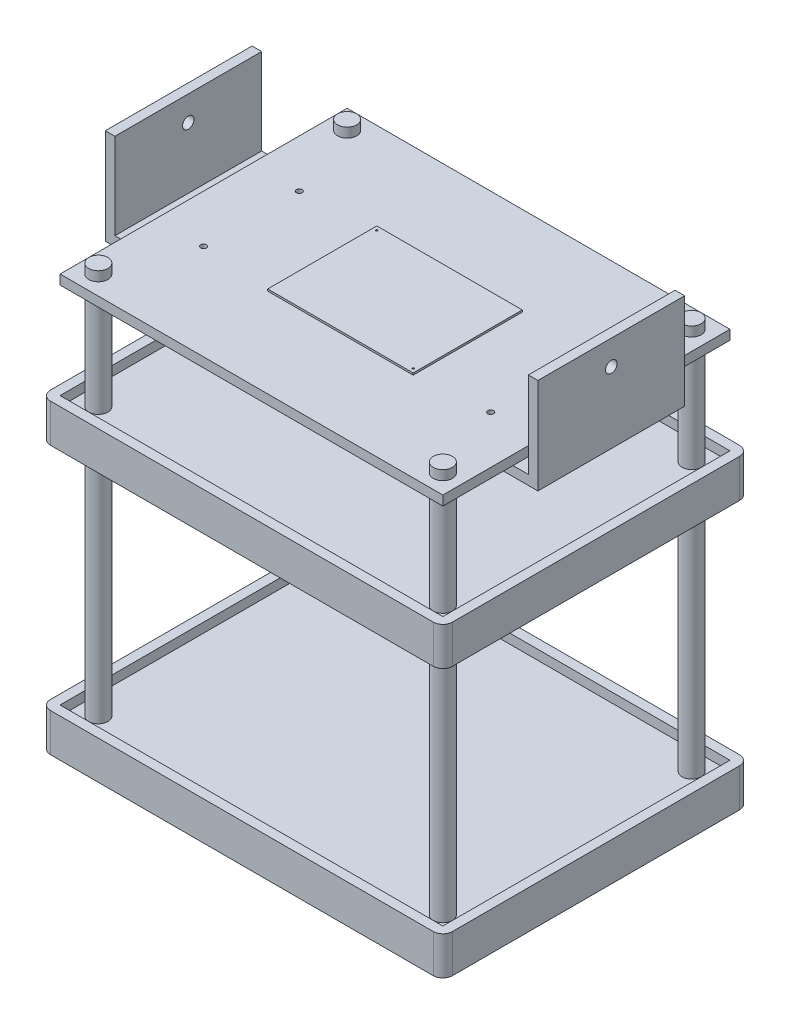
from build123d import *

# Parameters (mm, degrees)
SKETCH1_W            = 200
SKETCH1_H            = 150
BOSS_EXTRUDE1_DEPTH  = 5
SKETCH2_R            = 5
CUT_EXTRUDE1_DEPTH   = 10
SKETCH3_W            = 200
SKETCH3_H            = 150
SKETCH3_R            = 5
BOSS_EXTRUDE2_DEPTH  = 5
SKETCH4_W            = 200
SKETCH4_H            = 150
SKETCH4_R            = 5
BOSS_EXTRUDE3_DEPTH  = 5
BOSS_EXTRUDE13_START = 205
SKETCH21_R           = 5
BOSS_EXTRUDE13_DEPTH = 205
SKETCH22_R           = 5
BOSS_EXTRUDE14_DEPTH = 15
SKETCH23_R           = 1.5
CUT_EXTRUDE2_DEPTH   = 10
SKETCH27_W           = 76
SKETCH27_H           = 57
BOSS_EXTRUDE16_DEPTH = 1
SKETCH30_R           = 0.5
CUT_EXTRUDE3_DEPTH   = 30
SKETCH35_W           = 210
SKETCH35_H           = 160
SKETCH35_W_2         = 200
SKETCH35_H_2         = 150
BOSS_EXTRUDE19_DEPTH = 10
FILLET4_R            = 5
SKETCH39_W           = 210
SKETCH39_H           = 160
SKETCH39_W_2         = 200
SKETCH39_H_2         = 150
BOSS_EXTRUDE20_DEPTH = 10
FILLET5_R            = 5
SKETCH42_W           = 15
SKETCH42_H           = 20
SKETCH42_W_2         = 25
SKETCH42_H_2         = 50
SKETCH42_W_3         = 43.3
SKETCH42_H_3         = 43.3
BOSS_EXTRUDE23_DEPTH = 1
SKETCH46_W           = 30
SKETCH46_H           = 76.670556204
BOSS_EXTRUDE24_DEPTH = 5
SKETCH48_W           = 76.670556204
SKETCH48_H           = 50
BOSS_EXTRUDE25_DEPTH = 5
SKETCH49_R           = 3
CUT_EXTRUDE4_DEPTH   = 5
SKETCH54_W           = 76.670556204
SKETCH54_H           = 50
BOSS_EXTRUDE26_DEPTH = 5
CUT_EXTRUDE5_START   = -5
SKETCH55_R           = 3
CUT_EXTRUDE5_DEPTH   = 5


with BuildPart() as part:
    # Sketch1 → Boss-Extrude1 (new body)
    with BuildSketch(Plane(origin=(0, 0, 0), x_dir=(1, 0, 0), z_dir=(0, 1, 0))):
        Rectangle(SKETCH1_W, SKETCH1_H)
    extrude(amount=BOSS_EXTRUDE1_DEPTH)

    # Sketch2 → Cut-Extrude1 (cut)
    with BuildSketch(Plane(origin=(0, 5, 0), x_dir=(1, 0, 0), z_dir=(0, 1, 0))):
        with Locations(Location((-90, 65, 0), (0, 0, 270))):
            Circle(SKETCH2_R)
        with Locations(Location((90, 65, 0), (0, 0, 270))):
            Circle(SKETCH2_R)
        with Locations(Location((90, -65, 0), (0, 0, 270))):
            Circle(SKETCH2_R)
        with Locations(Location((-90, -65, 0), (0, 0, 270))):
            Circle(SKETCH2_R)
    extrude(amount=-CUT_EXTRUDE1_DEPTH, mode=Mode.SUBTRACT)



with BuildPart() as body_2:
    # Sketch3 → Boss-Extrude2 (new body)
    with BuildSketch(Plane(origin=(0, 140, 0), x_dir=(1, 0, 0), z_dir=(0, 1, 0))):
        Rectangle(SKETCH3_W, SKETCH3_H)
        with Locations(Location((-90, 65, 0), (0, 0, 270))):
            Circle(SKETCH3_R, mode=Mode.SUBTRACT)
        with Locations(Location((90, 65, 0), (0, 0, 270))):
            Circle(SKETCH3_R, mode=Mode.SUBTRACT)
        with Locations(Location((-90, -65, 0), (0, 0, 270))):
            Circle(SKETCH3_R, mode=Mode.SUBTRACT)
        with Locations(Location((90, -65, 0), (0, 0, 270))):
            Circle(SKETCH3_R, mode=Mode.SUBTRACT)
    extrude(amount=BOSS_EXTRUDE2_DEPTH)



with BuildPart() as body_3:
    # Sketch4 → Boss-Extrude3 (new body)
    with BuildSketch(Plane(origin=(0, 200, 0), x_dir=(1, 0, 0), z_dir=(0, 1, 0))):
        Rectangle(SKETCH4_W, SKETCH4_H)
        with Locations(Location((-90, 65, 0), (0, 0, 270))):
            Circle(SKETCH4_R, mode=Mode.SUBTRACT)
        with Locations(Location((90, 65, 0), (0, 0, 270))):
            Circle(SKETCH4_R, mode=Mode.SUBTRACT)
        with Locations(Location((90, -65, 0), (0, 0, 270))):
            Circle(SKETCH4_R, mode=Mode.SUBTRACT)
        with Locations(Location((-90, -65, 0), (0, 0, 270))):
            Circle(SKETCH4_R, mode=Mode.SUBTRACT)
    extrude(amount=BOSS_EXTRUDE3_DEPTH)


with BuildPart() as body_2_1:
    add(body_2.part)

    add(body_3.part)  # Boss-Extrude13 merges body 3
    # Sketch21 → Boss-Extrude13 (add)
    with BuildSketch(Plane(origin=(0, 5, 0), x_dir=(1, 0, 0), z_dir=(0, 1, 0)).offset(BOSS_EXTRUDE13_START)):
        with Locations(Location((-90, -65, 0), (0, 0, 270))):
            Circle(SKETCH21_R)
        with Locations(Location((-90, 65, 0), (0, 0, 270))):
            Circle(SKETCH21_R)
        with Locations(Location((90, 65, 0), (0, 0, 270))):
            Circle(SKETCH21_R)
        with Locations(Location((90, -65, 0), (0, 0, 270))):
            Circle(SKETCH21_R)
    extrude(amount=-BOSS_EXTRUDE13_DEPTH)


with BuildPart() as part_1:
    add(part.part)

    add(body_2_1.part)  # Boss-Extrude14 merges body 2
    # Sketch22 → Boss-Extrude14 (add)
    with BuildSketch(Plane(origin=(0, 5, 0), x_dir=(1, 0, 0), z_dir=(0, 1, 0))):
        with Locations(Location((-90, 65, 0), (0, 0, 270))):
            Circle(SKETCH22_R)
        with Locations(Location((-90, -65, 0), (0, 0, 270))):
            Circle(SKETCH22_R)
        with Locations(Location((90, -65, 0), (0, 0, 270))):
            Circle(SKETCH22_R)
        with Locations(Location((90, 65, 0), (0, 0, 270))):
            Circle(SKETCH22_R)
    extrude(amount=-BOSS_EXTRUDE14_DEPTH)

    # Sketch23 → Cut-Extrude2 (cut)
    with BuildSketch(Plane(origin=(0, 205, 0), x_dir=(1, 0, 0), z_dir=(0, 1, 0))):
        with Locations(Location((-75, 25, 0), (0, 0, 270))):
            Circle(SKETCH23_R)
        with Locations(Location((-75, -25, 0), (0, 0, 270))):
            Circle(SKETCH23_R)
        with Locations(Location((75, -25, 0), (0, 0, 270))):
            Circle(SKETCH23_R)
        with Locations(Location((75, 25, 0), (0, 0, 270))):
            Circle(SKETCH23_R)
    extrude(amount=-CUT_EXTRUDE2_DEPTH, mode=Mode.SUBTRACT)

    # Sketch27 → Boss-Extrude16 (add)
    with BuildSketch(Plane(origin=(0, 205, 0), x_dir=(1, 0, 0), z_dir=(0, 1, 0))):
        Rectangle(SKETCH27_W, SKETCH27_H)
    extrude(amount=BOSS_EXTRUDE16_DEPTH)

    # Sketch30 → Cut-Extrude3 (cut)
    with BuildSketch(Plane(origin=(0, 206, 0), x_dir=(1, 0, 0), z_dir=(0, 1, 0))):
        with Locations(Location((-36, 26.5, 0), (0, 0, 270))):
            Circle(SKETCH30_R)
        with Locations(Location((36, -26.5, 0), (0, 0, 270))):
            Circle(SKETCH30_R)
    extrude(amount=-CUT_EXTRUDE3_DEPTH, mode=Mode.SUBTRACT)

    # Sketch42 → Boss-Extrude23 (add)
    with BuildSketch(Plane.XZ.offset(-200)):
        Rectangle(SKETCH42_W, SKETCH42_H)
        with Locations((-58.240305189, 7.803312526)):
            Rectangle(SKETCH42_W_2, SKETCH42_H_2)
        with Locations((37.35, 2.211754737)):
            Rectangle(SKETCH42_W_3, SKETCH42_H_3)
    extrude(amount=BOSS_EXTRUDE23_DEPTH)

    # Sketch46 → Boss-Extrude24 (add)
    with BuildSketch(Plane(origin=(0, 200, 0), x_dir=(-1, 0, 0), z_dir=(0, -1, 0))):
        with Locations((-93, 0)):
            Rectangle(SKETCH46_W, SKETCH46_H)
        with Locations((93, 0)):
            Rectangle(SKETCH46_W, SKETCH46_H)
    extrude(amount=BOSS_EXTRUDE24_DEPTH)

    # Sketch48 → Boss-Extrude25 (add)
    with BuildSketch(Plane.ZY.offset(108)):
        with Locations((0, 220)):
            Rectangle(SKETCH48_W, SKETCH48_H)
    extrude(amount=BOSS_EXTRUDE25_DEPTH)

    # Sketch49 → Cut-Extrude4 (cut)
    with BuildSketch(Plane.ZY.offset(113)):
        with Locations((0, 232)):
            Circle(SKETCH49_R)
    extrude(amount=-CUT_EXTRUDE4_DEPTH, mode=Mode.SUBTRACT)

    # Sketch54 → Boss-Extrude26 (add)
    with BuildSketch(Plane(origin=(108, 0, 0), x_dir=(0, 0, -1), z_dir=(1, 0, 0))):
        with Locations((0, 220)):
            Rectangle(SKETCH54_W, SKETCH54_H)
    extrude(amount=BOSS_EXTRUDE26_DEPTH)

    # Sketch55 → Cut-Extrude5 (cut)
    with BuildSketch(Plane(origin=(113, 0, 0), x_dir=(0, 0, -1), z_dir=(1, 0, 0)).offset(CUT_EXTRUDE5_START)):
        with Locations(Location((0, 232, 0), (0, 0, 180))):
            Circle(SKETCH55_R)
    extrude(amount=CUT_EXTRUDE5_DEPTH, mode=Mode.SUBTRACT)


with BuildPart() as body_2_2:
    # Sketch35 → Boss-Extrude19 (new, symmetric)
    with BuildSketch(Plane(origin=(0, 0, 0), x_dir=(-1, 0, 0), z_dir=(0, -1, 0))):
        Rectangle(SKETCH35_W, SKETCH35_H)
        Rectangle(SKETCH35_W_2, SKETCH35_H_2, mode=Mode.SUBTRACT)
    extrude(amount=BOSS_EXTRUDE19_DEPTH, both=True)

    # Fillet4
    fillet4_edges = [body_2_2.edges().sort_by_distance(p)[0] for p in [
        (105, 0, -80),
        (-105, 0, -80),
        (-105, 0, 80),
        (105, 0, 80),
    ]]
    fillet(fillet4_edges, radius=FILLET4_R)


with BuildPart() as body_3_2:
    # Sketch39 → Boss-Extrude20 (new, symmetric)
    with BuildSketch(Plane.XZ.offset(-140)):
        Rectangle(SKETCH39_W, SKETCH39_H)
        Rectangle(SKETCH39_W_2, SKETCH39_H_2, mode=Mode.SUBTRACT)
    extrude(amount=BOSS_EXTRUDE20_DEPTH, both=True)

    # Fillet5
    fillet5_edges = [body_3_2.edges().sort_by_distance(p)[0] for p in [
        (105, 140, -80),
        (-105, 140, -80),
        (-105, 140, 80),
        (105, 140, 80),
    ]]
    fillet(fillet5_edges, radius=FILLET5_R)


solid = Compound([part_1.part, body_2_2.part, body_3_2.part])
